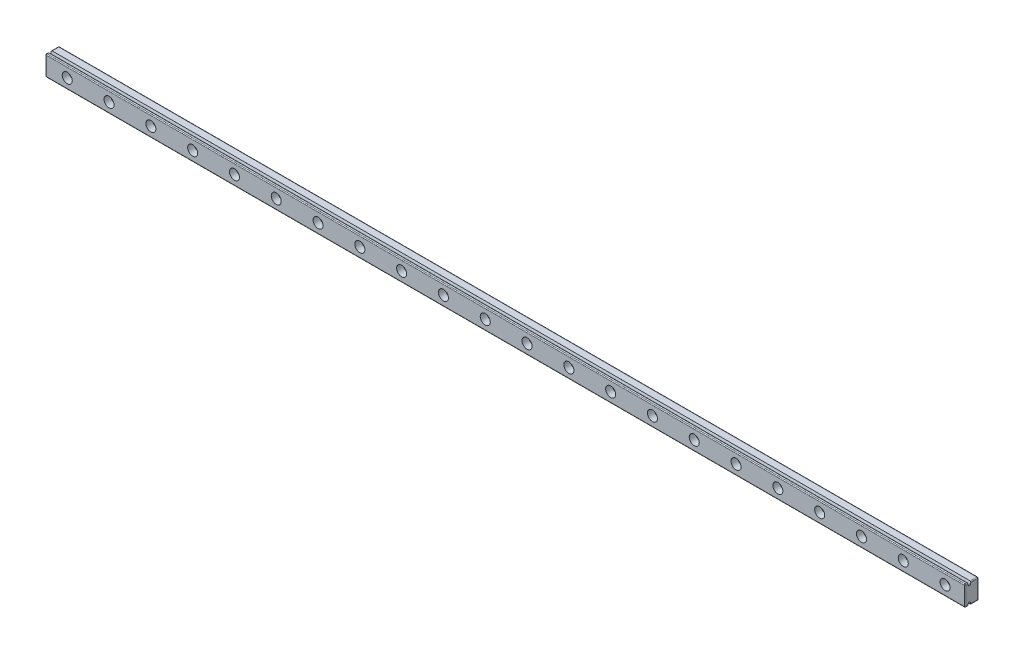
from build123d import *
from OCP.BRepFilletAPI import BRepFilletAPI_MakeChamfer

# Parameters (mm, degrees)
BOSS_EXTRUDE1_DEPTH = 550
SKETCH2_R           = 1.75
CUT_EXTRUDE1_DEPTH  = 10
SKETCH3_R           = 3
CUT_EXTRUDE2_DEPTH  = 4
CHAMFER1_SIZE       = 0.5
CHAMFER1_SIZE2      = 1.743707222
FILLET1_R           = 0.5


with BuildPart() as part:
    # Sketch1 → Boss-Extrude1 (new body)
    with BuildSketch(Plane(origin=(0, 0, 0), x_dir=(0, 0, -1), z_dir=(1, 0, 0))):
        Polygon((-0.5, 6), (4, 6), (4, -6), (-0.5, -6), (-0.5, -4.25), (-2.5, -4.25), (-2.5, -6), (-4, -6), (-4, 6), (-2.5, 6), (-2.5, 4.25), (-0.5, 4.25), align=None)
    extrude(amount=BOSS_EXTRUDE1_DEPTH)

    # Sketch2 → Cut-Extrude1 (cut)
    with BuildSketch(Plane.XY.offset(4)):
        with Locations((13, 0)):
            Circle(SKETCH2_R)
        with Locations((38, 0)):
            Circle(SKETCH2_R)
        with Locations((63, 0)):
            Circle(SKETCH2_R)
        with Locations((88, 0)):
            Circle(SKETCH2_R)
        with Locations((113, 0)):
            Circle(SKETCH2_R)
        with Locations((138, 0)):
            Circle(SKETCH2_R)
        with Locations((163, 0)):
            Circle(SKETCH2_R)
        with Locations((188, 0)):
            Circle(SKETCH2_R)
        with Locations((213, 0)):
            Circle(SKETCH2_R)
        with Locations((238, 0)):
            Circle(SKETCH2_R)
        with Locations((263, 0)):
            Circle(SKETCH2_R)
        with Locations((288, 0)):
            Circle(SKETCH2_R)
        with Locations((313, 0)):
            Circle(SKETCH2_R)
        with Locations((338, 0)):
            Circle(SKETCH2_R)
        with Locations((363, 0)):
            Circle(SKETCH2_R)
        with Locations((388, 0)):
            Circle(SKETCH2_R)
        with Locations((413, 0)):
            Circle(SKETCH2_R)
        with Locations((438, 0)):
            Circle(SKETCH2_R)
        with Locations((463, 0)):
            Circle(SKETCH2_R)
        with Locations((488, 0)):
            Circle(SKETCH2_R)
        with Locations((513, 0)):
            Circle(SKETCH2_R)
        with Locations((538, 0)):
            Circle(SKETCH2_R)
    extrude(amount=-CUT_EXTRUDE1_DEPTH, mode=Mode.SUBTRACT)

    # Sketch3 → Cut-Extrude2 (cut)
    with BuildSketch(Plane.XY.offset(4)):
        with Locations((13, 0)):
            Circle(SKETCH3_R)
        with Locations((38, 0)):
            Circle(SKETCH3_R)
        with Locations((63, 0)):
            Circle(SKETCH3_R)
        with Locations((88, 0)):
            Circle(SKETCH3_R)
        with Locations((113, 0)):
            Circle(SKETCH3_R)
        with Locations((138, 0)):
            Circle(SKETCH3_R)
        with Locations((163, 0)):
            Circle(SKETCH3_R)
        with Locations((188, 0)):
            Circle(SKETCH3_R)
        with Locations((213, 0)):
            Circle(SKETCH3_R)
        with Locations((238, 0)):
            Circle(SKETCH3_R)
        with Locations((263, 0)):
            Circle(SKETCH3_R)
        with Locations((288, 0)):
            Circle(SKETCH3_R)
        with Locations((313, 0)):
            Circle(SKETCH3_R)
        with Locations((338, 0)):
            Circle(SKETCH3_R)
        with Locations((363, 0)):
            Circle(SKETCH3_R)
        with Locations((388, 0)):
            Circle(SKETCH3_R)
        with Locations((413, 0)):
            Circle(SKETCH3_R)
        with Locations((438, 0)):
            Circle(SKETCH3_R)
        with Locations((463, 0)):
            Circle(SKETCH3_R)
        with Locations((488, 0)):
            Circle(SKETCH3_R)
        with Locations((513, 0)):
            Circle(SKETCH3_R)
        with Locations((538, 0)):
            Circle(SKETCH3_R)
    extrude(amount=-CUT_EXTRUDE2_DEPTH, mode=Mode.SUBTRACT)

    # Chamfer1: one chamfer whose edges measure the first distance from different faces: ONE call of the kernel's chamfer builder (chamfer() names one face for all edges)
    chamfer1_edges_1 = [part.edges().sort_by_distance(p)[0] for p in [
        (275, -4.25, 0.5),
        (275, -4.25, 2.5),
    ]]
    chamfer1_side_1 = [part.faces().sort_by_distance(p)[0] for p in [
        (275, -4.25, 1.5),
    ]]
    chamfer1_edges_2 = [part.edges().sort_by_distance(p)[0] for p in [
        (275, 4.25, 2.5),
        (275, 4.25, 0.5),
    ]]
    chamfer1_side_2 = [part.faces().sort_by_distance(p)[0] for p in [
        (275, 4.25, 1.5),
    ]]
    chamfer1 = BRepFilletAPI_MakeChamfer(part.part.solid().wrapped)
    for e in chamfer1_edges_1:
        chamfer1.Add(CHAMFER1_SIZE, CHAMFER1_SIZE2, e.wrapped, chamfer1_side_1[0].wrapped)  # the first distance lies on this face
    for e in chamfer1_edges_2:
        chamfer1.Add(CHAMFER1_SIZE, CHAMFER1_SIZE2, e.wrapped, chamfer1_side_2[0].wrapped)  # the first distance lies on this face
    add(Compound.cast(chamfer1.Shape()), mode=Mode.REPLACE)

    # Fillet1
    fillet1_edges = [part.edges().sort_by_distance(p)[0] for p in [
        (550, -6, -1.75),
        (550, 0, -4),
        (550, 6, -1.75),
        (550, 6, 3.25),
        (550, 0, 4),
        (550, -6, 3.25),
        (0, -6, 3.25),
        (0, -6, -1.75),
        (0, 0, -4),
        (0, 6, -1.75),
        (0, 6, 3.25),
        (0, 0, 4),
        (275, -4.25, 1),
        (275, -4.25, 2),
        (275, 4.25, 2),
        (275, 4.25, 1),
        (275, -6, 4),
        (275, 6, 4),
        (275, -6, -4),
        (275, 6, -4),
    ]]
    fillet(fillet1_edges, radius=FILLET1_R)


solid = part.part
